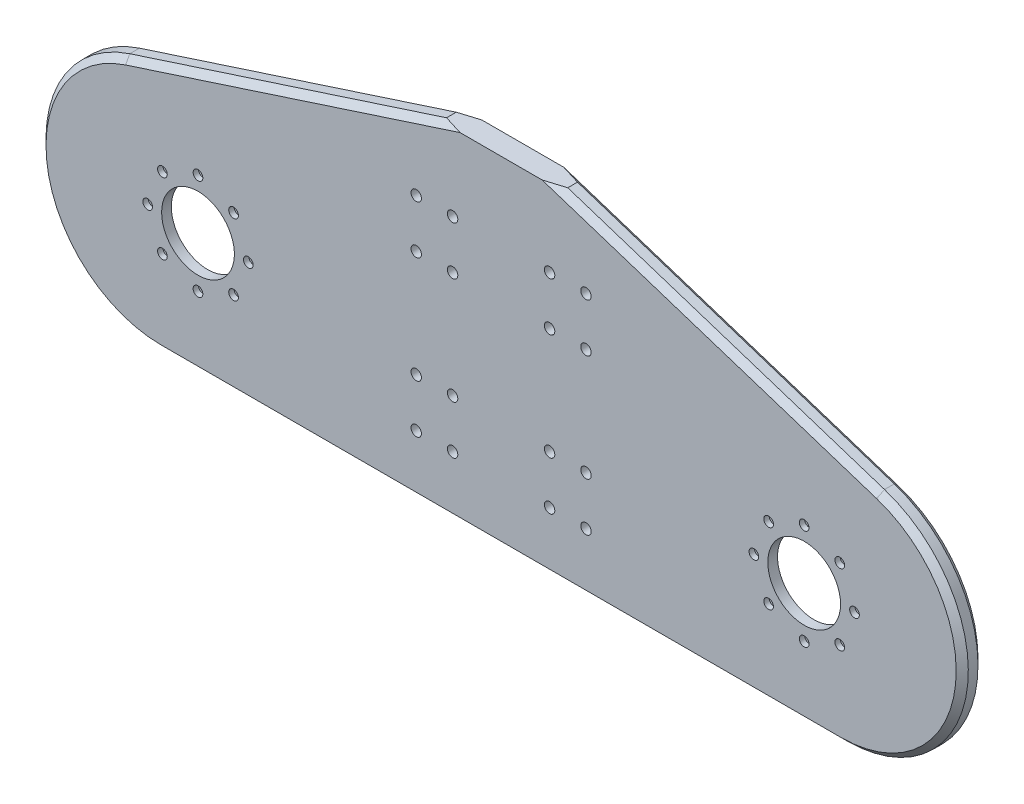
from build123d import *

# Parameters (mm, degrees)
SKETCH_1_R               = 30
EXTRUDE_1_DEPTH          = 8
FILLET_1_R               = 100
FILLET_3_R               = 100
EXTRUDE_2_DEPTH          = 10
FILLET_2_R               = 10
CHAMFER_1_SIZE           = 5
CUT_EXTRUDE_4_DEPTH      = 514.758413114
CUT_EXTRUDE_4_DEPTH_BACK = 514.758413114
SKETCH_7_R               = 4.3
CUT_EXTRUDE_5_DEPTH      = 514.758413114
CUT_EXTRUDE_5_DEPTH_BACK = 514.758413114
SKETCH_8_R               = 2.25
SKETCH_9_R               = 4
CUT_EXTRUDE_6_DEPTH      = 4.4
SKETCH_10_W              = 20
SKETCH_10_H              = 20
CUT_EXTRUDE_7_DEPTH      = 4
FILLET_4_R               = 3


with BuildPart() as part:
    # 草图1 → 凸台-拉伸1 (new body)
    with BuildSketch(Plane.XY):
        Polygon((0, 280), (861.751390409, 0), (0, 0), (-100, 0), (-961.751390409, 0), (-100, 280), align=None)
        with Locations((200, 100)):
            Circle(SKETCH_1_R, mode=Mode.SUBTRACT)
        with Locations(Location((-300, 100, 0), (0, 0, 180))):
            Circle(SKETCH_1_R, mode=Mode.SUBTRACT)
    extrude(amount=EXTRUDE_1_DEPTH)

    # 圆角1
    fillet_1_edges = [part.edges().sort_by_distance(p)[0] for p in [
        (861.751390409, 0, 4),
    ]]
    fillet(fillet_1_edges, radius=FILLET_1_R)

    # 圆角3
    fillet_3_edges = [part.edges().sort_by_distance(p)[0] for p in [
        (-961.751390409, 0, 4),
    ]]
    fillet(fillet_3_edges, radius=FILLET_3_R)

    # 草图2 → 凸台-拉伸2 (add)
    with BuildSketch(Plane.XY):
        with BuildLine():
            Line((0, 280), (-100, 280))
            Line((-100, 280), (-361.277938379, 195.10565163))
            ThreePointArc((-361.277938379, 195.10565163), (-429.145073001, 84.356553496), (-330.376238942, 0))
            Line((-330.376238942, 0), (230.376238942, 0))
            ThreePointArc((230.376238942, 0), (329.145073001, 84.356553496), (261.277938379, 195.10565163))
            Line((261.277938379, 195.10565163), (0, 280))
        make_face()
        Polygon((10, 266.236180795), (122.241374643, 229.766747442), (10, 35.358983849), align=None, mode=Mode.SUBTRACT)
        with BuildLine():
            Line((230.376238942, 10), (30, 10))
            Line((30, 10), (151.410485182, 220.289128906))
            Line((151.410485182, 220.289128906), (258.187768435, 185.595086467))
            ThreePointArc((258.187768435, 185.595086467), (319.268189595, 85.920898146), (230.376238942, 10))
        make_face(mode=Mode.SUBTRACT)
        Polygon((-110, 266.236180795), (-110, 35.358983849), (-222.241374643, 229.766747442), align=None, mode=Mode.SUBTRACT)
        with BuildLine():
            Line((-358.187768435, 185.595086467), (-251.410485182, 220.289128906))
            Line((-251.410485182, 220.289128906), (-130, 10))
            Line((-130, 10), (-330.376238942, 10))
            ThreePointArc((-330.376238942, 10), (-419.268189595, 85.920898146), (-358.187768435, 185.595086467))
        make_face(mode=Mode.SUBTRACT)
    extrude(amount=-EXTRUDE_2_DEPTH)

    # 圆角2
    fillet_2_edges = [part.edges().sort_by_distance(p)[0] for p in [
        (-110, 35.358983849, -5),
        (-110, 266.236180795, -5),
        (-130, 10, -5),
        (10, 266.236180795, -5),
        (10, 35.358983849, -5),
        (151.410485182, 220.289128906, -5),
        (30, 10, -5),
        (-251.410485182, 220.289128906, -5),
        (122.241374643, 229.766747442, -5),
        (-222.241374643, 229.766747442, -5),
    ]]
    fillet(fillet_2_edges, radius=FILLET_2_R)

    # 倒角1
    chamfer_1_edges = [part.edges().sort_by_distance(p)[0] for p in [
        (-230.63896919, 237.552825815, 8),
        (130.63896919, 237.552825815, 8),
        (329.145073001, 84.356553496, 8),
        (-50, 0, 8),
        (-429.145073001, 84.356553496, 8),
        (-230.63896919, 237.552825815, -10),
        (130.63896919, 237.552825815, -10),
        (329.145073001, 84.356553496, -10),
        (-50, 0, -10),
        (-429.145073001, 84.356553496, -10),
    ]]
    chamfer(chamfer_1_edges, length=CHAMFER_1_SIZE)

    # 草图7 → 切除-拉伸4 (cut, two sides: drawn at the far end of the back side and taken through both)
    with BuildSketch(Plane.XY.offset(8).offset(-CUT_EXTRUDE_4_DEPTH_BACK)):
        with Locations((20, 217)):
            Circle(SKETCH_7_R)
        with Locations((-10, 217)):
            Circle(SKETCH_7_R)
        with Locations((20, 177)):
            Circle(SKETCH_7_R)
        with Locations((-10, 177)):
            Circle(SKETCH_7_R)
        with Locations((20, 89)):
            Circle(SKETCH_7_R)
        with Locations((-10, 89)):
            Circle(SKETCH_7_R)
        with Locations((20, 49)):
            Circle(SKETCH_7_R)
        with Locations((-10, 49)):
            Circle(SKETCH_7_R)
        with Locations(Location((-90, 49, 0), (0, 0, 180))):
            Circle(SKETCH_7_R)
        with Locations(Location((-120, 49, 0), (0, 0, 180))):
            Circle(SKETCH_7_R)
        with Locations(Location((-90, 89, 0), (0, 0, 180))):
            Circle(SKETCH_7_R)
        with Locations(Location((-120, 89, 0), (0, 0, 180))):
            Circle(SKETCH_7_R)
        with Locations(Location((-90, 177, 0), (0, 0, 180))):
            Circle(SKETCH_7_R)
        with Locations(Location((-120, 177, 0), (0, 0, 180))):
            Circle(SKETCH_7_R)
        with Locations(Location((-90, 217, 0), (0, 0, 180))):
            Circle(SKETCH_7_R)
        with Locations(Location((-120, 217, 0), (0, 0, 180))):
            Circle(SKETCH_7_R)
    extrude(amount=CUT_EXTRUDE_4_DEPTH + CUT_EXTRUDE_4_DEPTH_BACK, mode=Mode.SUBTRACT)

    # 草图8 → 切除-拉伸5 (cut, two sides: drawn at the far end of the back side and taken through both)
    with BuildSketch(Plane.XY.offset(8).offset(-CUT_EXTRUDE_5_DEPTH_BACK)):
        with Locations((200, 141.5)):
            Circle(SKETCH_8_R)
        with Locations((229.344931419, 129.344931419)):
            Circle(SKETCH_8_R)
        with Locations((241.5, 100)):
            Circle(SKETCH_8_R)
        with Locations((229.344931419, 70.655068581)):
            Circle(SKETCH_8_R)
        with Locations((200, 58.5)):
            Circle(SKETCH_8_R)
        with Locations((170.655068581, 70.655068581)):
            Circle(SKETCH_8_R)
        with Locations((158.5, 100)):
            Circle(SKETCH_8_R)
        with Locations((170.655068581, 129.344931419)):
            Circle(SKETCH_8_R)
        with Locations((-270.655068581, 129.344931419)):
            Circle(SKETCH_8_R)
        with Locations((-258.5, 100)):
            Circle(SKETCH_8_R)
        with Locations((-270.655068581, 70.655068581)):
            Circle(SKETCH_8_R)
        with Locations((-300, 58.5)):
            Circle(SKETCH_8_R)
        with Locations((-329.344931419, 70.655068581)):
            Circle(SKETCH_8_R)
        with Locations((-341.5, 100)):
            Circle(SKETCH_8_R)
        with Locations((-329.344931419, 129.344931419)):
            Circle(SKETCH_8_R)
        with Locations((-300, 141.5)):
            Circle(SKETCH_8_R)
    extrude(amount=CUT_EXTRUDE_5_DEPTH + CUT_EXTRUDE_5_DEPTH_BACK, mode=Mode.SUBTRACT)

    # 草图9 → 切除-拉伸6 (cut)
    with BuildSketch(Plane.XY.offset(8)):
        with Locations((-300, 141.5)):
            Circle(SKETCH_9_R)
        with Locations((-270.655068581, 129.344931419)):
            Circle(SKETCH_9_R)
        with Locations((-258.5, 100)):
            Circle(SKETCH_9_R)
        with Locations((-270.655068581, 70.655068581)):
            Circle(SKETCH_9_R)
        with Locations((-300, 58.5)):
            Circle(SKETCH_9_R)
        with Locations((-329.344931419, 70.655068581)):
            Circle(SKETCH_9_R)
        with Locations((-341.5, 100)):
            Circle(SKETCH_9_R)
        with Locations((-329.344931419, 129.344931419)):
            Circle(SKETCH_9_R)
        with Locations(Location((229.344931419, 129.344931419, 0), (0, 0, 180))):
            Circle(SKETCH_9_R)
        with Locations(Location((241.5, 100, 0), (0, 0, 180))):
            Circle(SKETCH_9_R)
        with Locations(Location((229.344931419, 70.655068581, 0), (0, 0, 180))):
            Circle(SKETCH_9_R)
        with Locations(Location((200, 58.5, 0), (0, 0, 180))):
            Circle(SKETCH_9_R)
        with Locations(Location((170.655068581, 70.655068581, 0), (0, 0, 180))):
            Circle(SKETCH_9_R)
        with Locations(Location((158.5, 100, 0), (0, 0, 180))):
            Circle(SKETCH_9_R)
        with Locations(Location((170.655068581, 129.344931419, 0), (0, 0, 180))):
            Circle(SKETCH_9_R)
        with Locations(Location((200, 141.5, 0), (0, 0, 180))):
            Circle(SKETCH_9_R)
    extrude(amount=-CUT_EXTRUDE_6_DEPTH, mode=Mode.SUBTRACT)

    # 草图10 → 切除-拉伸7 (cut)
    with BuildSketch(Plane(origin=(0, 0, -10), x_dir=(-1, 0, 0), z_dir=(0, 0, -1))):
        with Locations((50, 100)):
            Rectangle(SKETCH_10_W, SKETCH_10_H)
    extrude(amount=-CUT_EXTRUDE_7_DEPTH, mode=Mode.SUBTRACT)

    # 圆角4
    fillet_4_edges = [part.edges().sort_by_distance(p)[0] for p in [
        (-40, 90, -8),
        (-40, 110, -8),
        (-60, 110, -8),
        (-60, 90, -8),
    ]]
    fillet(fillet_4_edges, radius=FILLET_4_R)


solid = part.part
